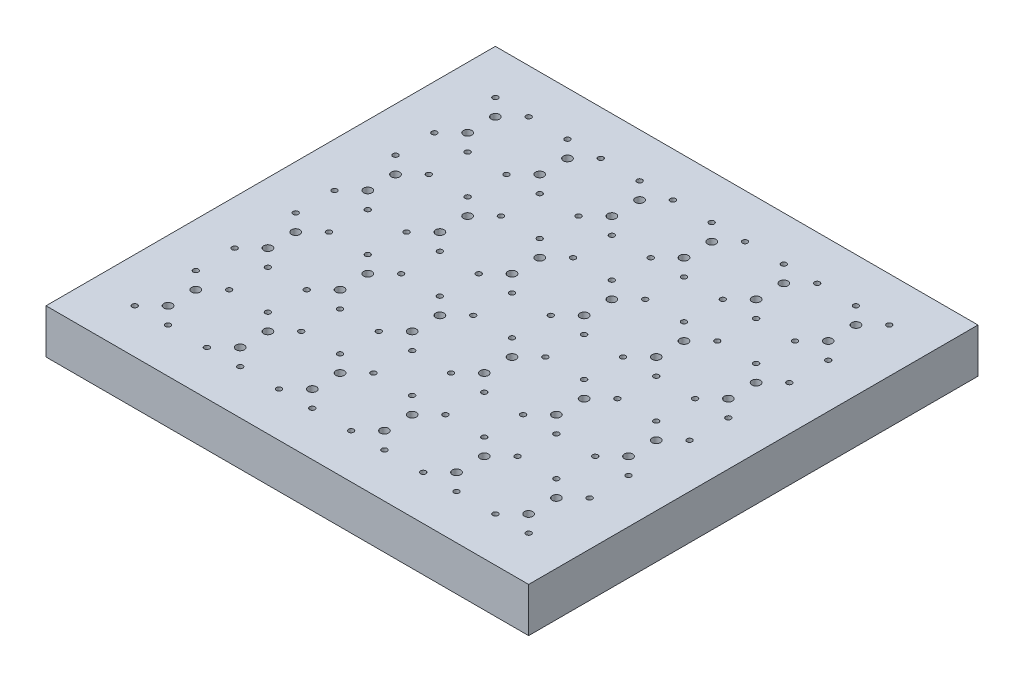
from build123d import *

# Parameters (mm, degrees)
SKETCH2_W                                           = 276.225
SKETCH2_H                                           = 257.175
BOSS_EXTRUDE1_DEPTH                                 = 25.4
CSK_FOR_1_4_FLAT_HEAD_MACHINE_SCREW_100_D           = 6.7564
CSK_FOR_1_4_FLAT_HEAD_MACHINE_SCREW_100_DEPTH       = 15.24
CSK_FOR_1_4_FLAT_HEAD_MACHINE_SCREW_100_CSINK_D     = 12.8778
CSK_FOR_1_4_FLAT_HEAD_MACHINE_SCREW_100_CSINK_ANGLE = 100
CSK_FOR_1_4_FLAT_HEAD_MACHINE_SCREW_100_TIP         = 2.029827343
SKETCH19_R                                          = 1.500000048
CUT_EXTRUDE16_DEPTH                                 = 8.89
SKETCH19_3_R                                        = 1.500000048
CUT_EXTRUDE17_DEPTH                                 = 8.89
SKETCH19_4_R                                        = 1.500000048
CUT_EXTRUDE18_DEPTH                                 = 8.89
SKETCH19_5_R                                        = 1.500000048
CUT_EXTRUDE19_DEPTH                                 = 8.89
SKETCH19_6_R                                        = 2.38125
CUT_EXTRUDE20_DEPTH                                 = 8.89
SKETCH19_7_R                                        = 2.38125
CUT_EXTRUDE21_DEPTH                                 = 8.89
SKETCH19_8_R                                        = 2.38125
CUT_EXTRUDE22_DEPTH                                 = 8.89


with BuildPart() as part:
    # Sketch2 → Boss-Extrude1 (new body)
    with BuildSketch(Plane(origin=(0, 0, 0), x_dir=(1, 0, 0), z_dir=(0, 1, 0))):
        with Locations((138.1125, 128.5875)):
            Rectangle(SKETCH2_W, SKETCH2_H)
    extrude(amount=BOSS_EXTRUDE1_DEPTH)

    # CSK for 1/4 Flat Head Machine Screw (100)1
    with Locations(Plane.XZ):
        with Locations((11.1125, -185.7375), (220.6625, -185.7375), (179.3875, -185.7375), (138.1125, -185.7375), (96.8375, -185.7375), (55.5625, -185.7375), (55.5625, -128.5875), (96.8375, -128.5875), (138.1125, -128.5875), (179.3875, -128.5875), (220.6625, -128.5875), (261.9375, -128.5875), (55.5625, -71.4375), (96.8375, -71.4375), (138.1125, -71.4375), (179.3875, -71.4375), (220.6625, -71.4375), (261.9375, -71.4375), (55.5625, -14.2875), (96.8375, -14.2875), (138.1125, -14.2875), (179.3875, -14.2875), (220.6625, -14.2875), (261.9375, -14.2875), (261.9375, -185.7375), (11.1125, -14.2875), (11.1125, -246.0625), (55.5625, -246.0625), (96.8375, -246.0625), (138.1125, -246.0625), (179.3875, -246.0625), (220.6625, -246.0625), (261.9375, -246.0625), (11.1125, -71.4375), (11.1125, -128.5875)):
            CounterSinkHole(CSK_FOR_1_4_FLAT_HEAD_MACHINE_SCREW_100_D / 2, CSK_FOR_1_4_FLAT_HEAD_MACHINE_SCREW_100_CSINK_D / 2, depth=CSK_FOR_1_4_FLAT_HEAD_MACHINE_SCREW_100_DEPTH, counter_sink_angle=CSK_FOR_1_4_FLAT_HEAD_MACHINE_SCREW_100_CSINK_ANGLE)
            with Locations((0, 0, -(CSK_FOR_1_4_FLAT_HEAD_MACHINE_SCREW_100_DEPTH + CSK_FOR_1_4_FLAT_HEAD_MACHINE_SCREW_100_TIP / 2))):  # 118° drill point
                Cone(0, CSK_FOR_1_4_FLAT_HEAD_MACHINE_SCREW_100_D / 2, CSK_FOR_1_4_FLAT_HEAD_MACHINE_SCREW_100_TIP, mode=Mode.SUBTRACT)

    # Sketch19 → Cut-Extrude16 (cut)
    with BuildSketch(Plane(origin=(0, 25.4, 0), x_dir=(1, 0, 0), z_dir=(0, 1, 0))):
        with Locations((44.45, 231.775)):
            Circle(SKETCH19_R)
        with Locations((25.4, 231.775)):
            Circle(SKETCH19_R)
        with Locations((25.4, 196.85)):
            Circle(SKETCH19_R)
        with Locations((44.45, 196.85)):
            Circle(SKETCH19_R)
        with Locations((85.725, 231.775)):
            Circle(SKETCH19_R)
        with Locations((66.675, 231.775)):
            Circle(SKETCH19_R)
        with Locations((66.675, 196.85)):
            Circle(SKETCH19_R)
        with Locations((85.725, 196.85)):
            Circle(SKETCH19_R)
        with Locations((127, 231.775)):
            Circle(SKETCH19_R)
        with Locations((107.95, 231.775)):
            Circle(SKETCH19_R)
        with Locations((107.95, 196.85)):
            Circle(SKETCH19_R)
        with Locations((127, 196.85)):
            Circle(SKETCH19_R)
        with Locations((168.275, 231.775)):
            Circle(SKETCH19_R)
        with Locations((149.225, 231.775)):
            Circle(SKETCH19_R)
        with Locations((149.225, 196.85)):
            Circle(SKETCH19_R)
        with Locations((168.275, 196.85)):
            Circle(SKETCH19_R)
        with Locations((209.55, 231.775)):
            Circle(SKETCH19_R)
        with Locations((190.5, 231.775)):
            Circle(SKETCH19_R)
        with Locations((190.5, 196.85)):
            Circle(SKETCH19_R)
        with Locations((209.55, 196.85)):
            Circle(SKETCH19_R)
        with Locations((250.825, 231.775)):
            Circle(SKETCH19_R)
        with Locations((231.775, 231.775)):
            Circle(SKETCH19_R)
        with Locations((231.775, 196.85)):
            Circle(SKETCH19_R)
        with Locations((250.825, 196.85)):
            Circle(SKETCH19_R)
        with Locations((168.275, 174.625)):
            Circle(SKETCH19_R)
        with Locations((168.275, 139.7)):
            Circle(SKETCH19_R)
        with Locations((209.55, 174.625)):
            Circle(SKETCH19_R)
        with Locations((190.5, 174.625)):
            Circle(SKETCH19_R)
        with Locations((190.5, 139.7)):
            Circle(SKETCH19_R)
        with Locations((209.55, 139.7)):
            Circle(SKETCH19_R)
        with Locations((250.825, 174.625)):
            Circle(SKETCH19_R)
        with Locations((231.775, 174.625)):
            Circle(SKETCH19_R)
        with Locations((231.775, 139.7)):
            Circle(SKETCH19_R)
        with Locations((250.825, 139.7)):
            Circle(SKETCH19_R)
    extrude(amount=-CUT_EXTRUDE16_DEPTH, mode=Mode.SUBTRACT)

    # Sketch19<3> → Cut-Extrude17 (cut)
    with BuildSketch(Plane(origin=(0, 25.4, 0), x_dir=(1, 0, 0), z_dir=(0, 1, 0))):
        with Locations((85.725, 174.625)):
            Circle(SKETCH19_3_R)
        with Locations((66.675, 174.625)):
            Circle(SKETCH19_3_R)
        with Locations((66.675, 139.7)):
            Circle(SKETCH19_3_R)
        with Locations((85.725, 139.7)):
            Circle(SKETCH19_3_R)
        with Locations((127, 174.625)):
            Circle(SKETCH19_3_R)
        with Locations((107.95, 174.625)):
            Circle(SKETCH19_3_R)
        with Locations((107.95, 139.7)):
            Circle(SKETCH19_3_R)
        with Locations((127, 139.7)):
            Circle(SKETCH19_3_R)
        with Locations((149.225, 174.625)):
            Circle(SKETCH19_3_R)
        with Locations((149.225, 139.7)):
            Circle(SKETCH19_3_R)
        with Locations((85.725, 117.475)):
            Circle(SKETCH19_3_R)
        with Locations((66.675, 117.475)):
            Circle(SKETCH19_3_R)
        with Locations((66.675, 82.55)):
            Circle(SKETCH19_3_R)
        with Locations((85.725, 82.55)):
            Circle(SKETCH19_3_R)
        with Locations((127, 117.475)):
            Circle(SKETCH19_3_R)
        with Locations((107.95, 117.475)):
            Circle(SKETCH19_3_R)
        with Locations((107.95, 82.55)):
            Circle(SKETCH19_3_R)
        with Locations((127, 82.55)):
            Circle(SKETCH19_3_R)
        with Locations((168.275, 117.475)):
            Circle(SKETCH19_3_R)
        with Locations((149.225, 117.475)):
            Circle(SKETCH19_3_R)
        with Locations((209.55, 117.475)):
            Circle(SKETCH19_3_R)
        with Locations((190.5, 117.475)):
            Circle(SKETCH19_3_R)
        with Locations((250.825, 117.475)):
            Circle(SKETCH19_3_R)
        with Locations((231.775, 117.475)):
            Circle(SKETCH19_3_R)
        with Locations((231.775, 82.55)):
            Circle(SKETCH19_3_R)
        with Locations((250.825, 82.55)):
            Circle(SKETCH19_3_R)
        with Locations((44.45, 174.625)):
            Circle(SKETCH19_3_R)
        with Locations((25.4, 174.625)):
            Circle(SKETCH19_3_R)
        with Locations((25.4, 139.7)):
            Circle(SKETCH19_3_R)
        with Locations((44.45, 139.7)):
            Circle(SKETCH19_3_R)
        with Locations((44.45, 117.475)):
            Circle(SKETCH19_3_R)
        with Locations((25.4, 117.475)):
            Circle(SKETCH19_3_R)
        with Locations((25.4, 82.55)):
            Circle(SKETCH19_3_R)
        with Locations((44.45, 82.55)):
            Circle(SKETCH19_3_R)
    extrude(amount=-CUT_EXTRUDE17_DEPTH, mode=Mode.SUBTRACT)

    # Sketch19<4> → Cut-Extrude18 (cut)
    with BuildSketch(Plane(origin=(0, 25.4, 0), x_dir=(1, 0, 0), z_dir=(0, 1, 0))):
        with Locations((149.225, 82.55)):
            Circle(SKETCH19_4_R)
        with Locations((168.275, 82.55)):
            Circle(SKETCH19_4_R)
        with Locations((190.5, 82.55)):
            Circle(SKETCH19_4_R)
        with Locations((209.55, 82.55)):
            Circle(SKETCH19_4_R)
        with Locations((85.725, 60.325)):
            Circle(SKETCH19_4_R)
        with Locations((66.675, 60.325)):
            Circle(SKETCH19_4_R)
        with Locations((66.675, 25.4)):
            Circle(SKETCH19_4_R)
        with Locations((85.725, 25.4)):
            Circle(SKETCH19_4_R)
        with Locations((127, 60.325)):
            Circle(SKETCH19_4_R)
        with Locations((107.95, 60.325)):
            Circle(SKETCH19_4_R)
        with Locations((107.95, 25.4)):
            Circle(SKETCH19_4_R)
        with Locations((127, 25.4)):
            Circle(SKETCH19_4_R)
        with Locations((168.275, 60.325)):
            Circle(SKETCH19_4_R)
        with Locations((149.225, 60.325)):
            Circle(SKETCH19_4_R)
        with Locations((149.225, 25.4)):
            Circle(SKETCH19_4_R)
        with Locations((168.275, 25.4)):
            Circle(SKETCH19_4_R)
        with Locations((209.55, 60.325)):
            Circle(SKETCH19_4_R)
        with Locations((190.5, 60.325)):
            Circle(SKETCH19_4_R)
        with Locations((190.5, 25.4)):
            Circle(SKETCH19_4_R)
        with Locations((250.825, 60.325)):
            Circle(SKETCH19_4_R)
        with Locations((231.775, 60.325)):
            Circle(SKETCH19_4_R)
        with Locations((231.775, 25.4)):
            Circle(SKETCH19_4_R)
        with Locations((250.825, 25.4)):
            Circle(SKETCH19_4_R)
    extrude(amount=-CUT_EXTRUDE18_DEPTH, mode=Mode.SUBTRACT)

    # Sketch19<5> → Cut-Extrude19 (cut)
    with BuildSketch(Plane(origin=(0, 25.4, 0), x_dir=(1, 0, 0), z_dir=(0, 1, 0))):
        with Locations((209.55, 25.4)):
            Circle(SKETCH19_5_R)
        with Locations((44.45, 60.325)):
            Circle(SKETCH19_5_R)
        with Locations((25.4, 60.325)):
            Circle(SKETCH19_5_R)
        with Locations((25.4, 25.4)):
            Circle(SKETCH19_5_R)
        with Locations((44.45, 25.4)):
            Circle(SKETCH19_5_R)
    extrude(amount=-CUT_EXTRUDE19_DEPTH, mode=Mode.SUBTRACT)

    # Sketch19<6> → Cut-Extrude20 (cut)
    with BuildSketch(Plane(origin=(0, 25.4, 0), x_dir=(1, 0, 0), z_dir=(0, 1, 0))):
        with Locations((34.925, 222.25)):
            Circle(SKETCH19_6_R)
        with Locations((34.925, 206.375)):
            Circle(SKETCH19_6_R)
        with Locations((76.2, 222.25)):
            Circle(SKETCH19_6_R)
        with Locations((76.2, 206.375)):
            Circle(SKETCH19_6_R)
        with Locations((117.475, 222.25)):
            Circle(SKETCH19_6_R)
        with Locations((117.475, 206.375)):
            Circle(SKETCH19_6_R)
        with Locations((158.75, 222.25)):
            Circle(SKETCH19_6_R)
        with Locations((158.75, 206.375)):
            Circle(SKETCH19_6_R)
        with Locations((200.025, 222.25)):
            Circle(SKETCH19_6_R)
        with Locations((200.025, 206.375)):
            Circle(SKETCH19_6_R)
        with Locations((241.3, 222.25)):
            Circle(SKETCH19_6_R)
        with Locations((241.3, 206.375)):
            Circle(SKETCH19_6_R)
        with Locations((76.2, 165.1)):
            Circle(SKETCH19_6_R)
        with Locations((117.475, 165.1)):
            Circle(SKETCH19_6_R)
        with Locations((158.75, 165.1)):
            Circle(SKETCH19_6_R)
        with Locations((200.025, 165.1)):
            Circle(SKETCH19_6_R)
        with Locations((241.3, 165.1)):
            Circle(SKETCH19_6_R)
        with Locations((34.925, 165.1)):
            Circle(SKETCH19_6_R)
    extrude(amount=-CUT_EXTRUDE20_DEPTH, mode=Mode.SUBTRACT)

    # Sketch19<7> → Cut-Extrude21 (cut)
    with BuildSketch(Plane(origin=(0, 25.4, 0), x_dir=(1, 0, 0), z_dir=(0, 1, 0))):
        with Locations((76.2, 149.225)):
            Circle(SKETCH19_7_R)
        with Locations((117.475, 149.225)):
            Circle(SKETCH19_7_R)
        with Locations((158.75, 149.225)):
            Circle(SKETCH19_7_R)
        with Locations((200.025, 149.225)):
            Circle(SKETCH19_7_R)
        with Locations((241.3, 149.225)):
            Circle(SKETCH19_7_R)
        with Locations((76.2, 107.95)):
            Circle(SKETCH19_7_R)
        with Locations((76.2, 92.075)):
            Circle(SKETCH19_7_R)
        with Locations((117.475, 107.95)):
            Circle(SKETCH19_7_R)
        with Locations((117.475, 92.075)):
            Circle(SKETCH19_7_R)
        with Locations((158.75, 107.95)):
            Circle(SKETCH19_7_R)
        with Locations((158.75, 92.075)):
            Circle(SKETCH19_7_R)
        with Locations((200.025, 107.95)):
            Circle(SKETCH19_7_R)
        with Locations((200.025, 92.075)):
            Circle(SKETCH19_7_R)
        with Locations((241.3, 107.95)):
            Circle(SKETCH19_7_R)
        with Locations((241.3, 92.075)):
            Circle(SKETCH19_7_R)
        with Locations((34.925, 149.225)):
            Circle(SKETCH19_7_R)
        with Locations((34.925, 107.95)):
            Circle(SKETCH19_7_R)
        with Locations((34.925, 92.075)):
            Circle(SKETCH19_7_R)
    extrude(amount=-CUT_EXTRUDE21_DEPTH, mode=Mode.SUBTRACT)

    # Sketch19<8> → Cut-Extrude22 (cut)
    with BuildSketch(Plane(origin=(0, 25.4, 0), x_dir=(1, 0, 0), z_dir=(0, 1, 0))):
        with Locations((76.2, 50.8)):
            Circle(SKETCH19_8_R)
        with Locations((76.2, 34.925)):
            Circle(SKETCH19_8_R)
        with Locations((117.475, 50.8)):
            Circle(SKETCH19_8_R)
        with Locations((117.475, 34.925)):
            Circle(SKETCH19_8_R)
        with Locations((158.75, 50.8)):
            Circle(SKETCH19_8_R)
        with Locations((158.75, 34.925)):
            Circle(SKETCH19_8_R)
        with Locations((200.025, 50.8)):
            Circle(SKETCH19_8_R)
        with Locations((200.025, 34.925)):
            Circle(SKETCH19_8_R)
        with Locations((241.3, 50.8)):
            Circle(SKETCH19_8_R)
        with Locations((241.3, 34.925)):
            Circle(SKETCH19_8_R)
        with Locations((34.925, 50.8)):
            Circle(SKETCH19_8_R)
        with Locations((34.925, 34.925)):
            Circle(SKETCH19_8_R)
    extrude(amount=-CUT_EXTRUDE22_DEPTH, mode=Mode.SUBTRACT)


solid = part.part
